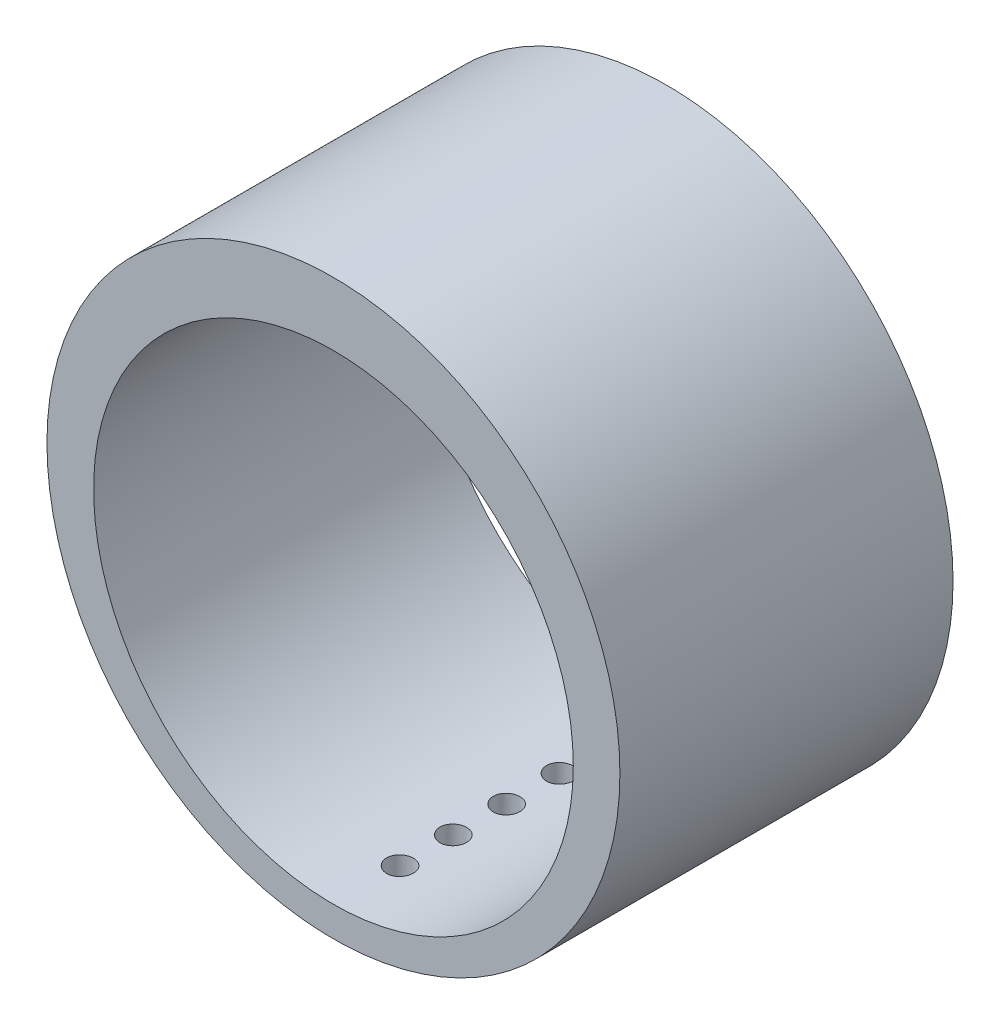
from build123d import *

# Parameters (mm, degrees)
ESQUISSE1_R             = 43
ESQUISSE1_R_2           = 36
BASE_EXTRUSION_DEPTH    = 50
ESQUISSE2_R             = 2
ENL_V_MAT_EXTRU_1_DEPTH = 81.120222166


with BuildPart() as part:
    # Esquisse1 → Base-Extrusion (new body)
    with BuildSketch(Plane.XY):
        with Locations((0, 2.5)):
            Circle(ESQUISSE1_R)
        Circle(ESQUISSE1_R_2, mode=Mode.SUBTRACT)
    extrude(amount=BASE_EXTRUSION_DEPTH)

    # Esquisse2 → Enlèv. mat.-Extru.1 (cut, through all)
    with BuildSketch(Plane(origin=(0, 0, 0), x_dir=(1, 0, 0), z_dir=(0, 1, 0))):
        with Locations((0, -8)):
            Circle(ESQUISSE2_R)
        with Locations((0, -16)):
            Circle(ESQUISSE2_R)
        with Locations((0, -24)):
            Circle(ESQUISSE2_R)
        with Locations((0, -32)):
            Circle(ESQUISSE2_R)
        with Locations((0, -40)):
            Circle(ESQUISSE2_R)
        with Locations((0, 92)):
            Circle(ESQUISSE2_R)
        with Locations((0, 84)):
            Circle(ESQUISSE2_R)
        with Locations((0, 76)):
            Circle(ESQUISSE2_R)
        with Locations((0, 68)):
            Circle(ESQUISSE2_R)
        with Locations((0, 60)):
            Circle(ESQUISSE2_R)
        with Locations((0, 192)):
            Circle(ESQUISSE2_R)
        with Locations((0, 184)):
            Circle(ESQUISSE2_R)
        with Locations((0, 176)):
            Circle(ESQUISSE2_R)
        with Locations((0, 168)):
            Circle(ESQUISSE2_R)
        with Locations((0, 160)):
            Circle(ESQUISSE2_R)
        with Locations((0, 292)):
            Circle(ESQUISSE2_R)
        with Locations((0, 284)):
            Circle(ESQUISSE2_R)
        with Locations((0, 276)):
            Circle(ESQUISSE2_R)
        with Locations((0, 268)):
            Circle(ESQUISSE2_R)
        with Locations((0, 260)):
            Circle(ESQUISSE2_R)
        with Locations((0, 392)):
            Circle(ESQUISSE2_R)
        with Locations((0, 384)):
            Circle(ESQUISSE2_R)
        with Locations((0, 376)):
            Circle(ESQUISSE2_R)
        with Locations((0, 368)):
            Circle(ESQUISSE2_R)
        with Locations((0, 360)):
            Circle(ESQUISSE2_R)
    extrude(amount=-ENL_V_MAT_EXTRU_1_DEPTH, mode=Mode.SUBTRACT)


solid = part.part
